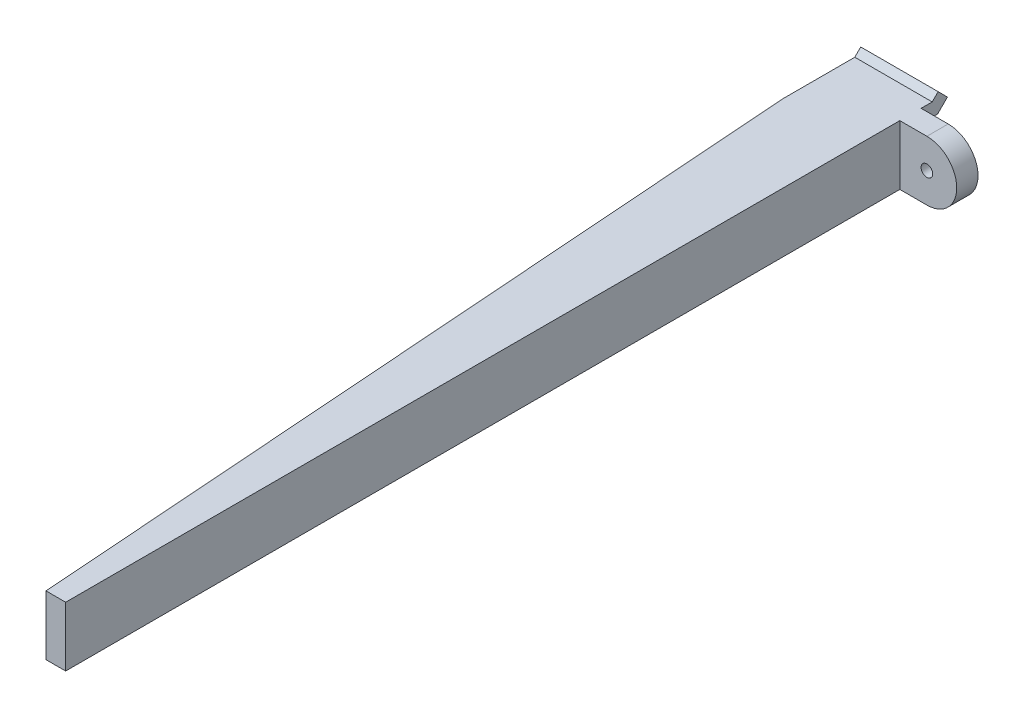
from build123d import *

# Parameters (mm, degrees)
SKETCH2_W           = 10
SKETCH2_H           = 14.768412439
BOSS_EXTRUDE1_DEPTH = 5
BOSS_EXTRUDE4_DEPTH = 10
SKETCH9_W           = 10
SKETCH9_H           = 3.18
SKETCH9_H_2         = 3.888412439
CUT_EXTRUDE3_DEPTH  = 5
BOSS_EXTRUDE5_DEPTH = 7.7
SKETCH12_R          = 0.75
BOSS_EXTRUDE7_DEPTH = 2.75
FILLET1_R           = 2.5
SKETCH13_W          = 17.887250462
SKETCH13_H          = 46.229219396
CUT_EXTRUDE4_DEPTH  = 20
SKETCH15_W          = 10
SKETCH15_H          = 7.7
BOSS_EXTRUDE9_DEPTH = 100
CUT_EXTRUDE5_DEPTH  = 100


with BuildPart() as part:
    # Sketch2 → Boss-Extrude1 (new body)
    with BuildSketch(Plane.XY):
        with Locations((0, 1.566049366)):
            Rectangle(SKETCH2_W, SKETCH2_H)
    extrude(amount=BOSS_EXTRUDE1_DEPTH)

    # Sketch8 → Boss-Extrude4 (add)
    with BuildSketch(Plane.ZY.offset(5)):
        Polygon((-0.15, 5.770255585), (0, 5.770255585), (0, 4.070255585), (-0.15, 4.070255585), (-2.137867966, 4.070255585), (-3.402081528, 5.334469147), (-2.2, 6.536550675), (-1.43370491, 5.770255585), align=None)
        Polygon((-0.15, -1.929744415), (0, -1.929744415), (0, -0.229744415), (-0.15, -0.229744415), (-1.43370491, -0.229744415), (-2.2, 0.536550675), (-3.402081528, -0.665530853), (-2.137867966, -1.929744415), align=None)
    extrude(amount=-BOSS_EXTRUDE4_DEPTH)

    # Sketch9 → Cut-Extrude3 (cut)
    with BuildSketch(Plane(origin=(0, 0, 0), x_dir=(-1, 0, 0), z_dir=(0, 0, -1))):
        with Locations((0, 7.360255585)):
            Rectangle(SKETCH9_W, SKETCH9_H)
        with Locations((0, -3.873950635)):
            Rectangle(SKETCH9_W, SKETCH9_H_2)
    extrude(amount=-CUT_EXTRUDE3_DEPTH, mode=Mode.SUBTRACT)

    # Sketch10 → Boss-Extrude5 (add)
    with BuildSketch(Plane(origin=(0, 5.770255585, 0), x_dir=(1, 0, 0), z_dir=(0, 1, 0))):
        with BuildLine():
            Line((-5, -5), (-5, -10.5))
            Line((-5, -10.5), (1.352445729, -55.7))
            Line((1.352445729, -55.7), (6.352445729, -55.7))
            Line((6.352445729, -55.7), (6.352445729, -49.2))
            ThreePointArc((6.352445729, -49.2), (1.383429579, -31.764936646), (5, -14))
            Line((5, -14), (5, -5))
            Line((5, -5), (-5, -5))
        make_face()
    extrude(amount=-BOSS_EXTRUDE5_DEPTH)

    # Sketch12 → Boss-Extrude7 (add)
    with BuildSketch(Plane.XY):
        with BuildLine():
            Line((5, 5.770255585), (8.5, 5.770255585))
            ThreePointArc((8.5, 5.770255585), (12.35, 1.920255585), (8.5, -1.929744415))
            Line((8.5, -1.929744415), (5, -1.929744415))
            Line((5, -1.929744415), (5, 5.770255585))
        make_face()
        with Locations((8.5, 1.920255585)):
            Circle(SKETCH12_R, mode=Mode.SUBTRACT)
    extrude(amount=BOSS_EXTRUDE7_DEPTH)

    # Fillet1
    fillet1_edges = [part.edges().sort_by_distance(p)[0] for p in [
        (6.352445729, 1.920255585, 49.2),
        (5, 1.920255585, 14),
        (1.352445729, 1.920255585, 55.7),
        (6.352445729, 1.920255585, 55.7),
    ]]
    fillet(fillet1_edges, radius=FILLET1_R)

    # Sketch13 → Cut-Extrude4 (cut)
    with BuildSketch(Plane(origin=(0, 5.770255585, 0), x_dir=(1, 0, 0), z_dir=(0, 1, 0))):
        with Locations((3.943625231, -33.614609698)):
            Rectangle(SKETCH13_W, SKETCH13_H)
    extrude(amount=-CUT_EXTRUDE4_DEPTH, mode=Mode.SUBTRACT)

    # Sketch15 → Boss-Extrude9 (add)
    with BuildSketch(Plane.XY.offset(10.5)):
        with Locations((0, 1.920255585)):
            Rectangle(SKETCH15_W, SKETCH15_H)
    extrude(amount=BOSS_EXTRUDE9_DEPTH)

    # Sketch16 → Cut-Extrude5 (cut)
    with BuildSketch(Plane(origin=(0, 5.770255585, 0), x_dir=(1, 0, 0), z_dir=(0, 1, 0))):
        Polygon((-5, -7.952810564), (2.461220142, -110.5), (-5, -110.5), align=None)
    extrude(amount=-CUT_EXTRUDE5_DEPTH, mode=Mode.SUBTRACT)


solid = part.part
